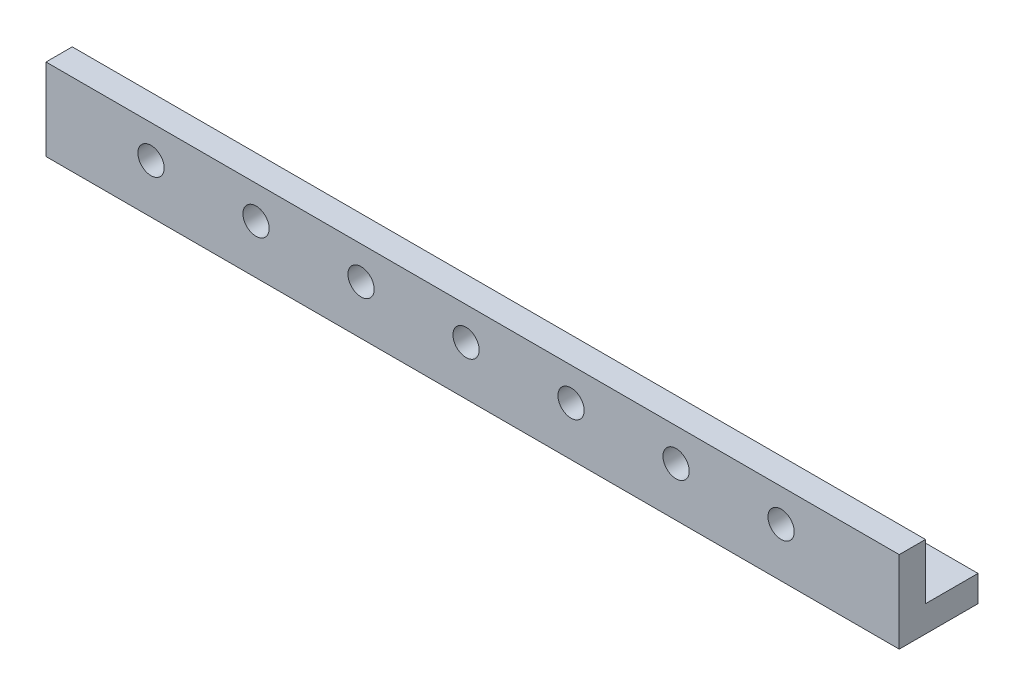
from build123d import *

# Parameters (mm, degrees)
BOSS_EXTRUDE1_DEPTH = 206.375
SKETCH2_R           = 3.175
CUT_EXTRUDE1_DEPTH  = 209.19716249
LPATTERN1_COUNT     = 7
LPATTERN1_PITCH     = 25.4


with BuildPart() as part:
    # Sketch1 → Boss-Extrude1 (new body)
    with BuildSketch(Plane(origin=(0, 0, 0), x_dir=(0, 0, -1), z_dir=(1, 0, 0))):
        Polygon((0, 0), (0, 19.812), (6.35, 19.812), (6.35, 6.35), (19.05, 6.35), (19.05, 0), align=None)
    extrude(amount=BOSS_EXTRUDE1_DEPTH)

    # Sketch2 → Cut-Extrude1 (cut, through all)
    with BuildSketch(Plane.XY):
        with Locations((25.4, 11.8745)):
            Circle(SKETCH2_R)
    cut_extrude1 = extrude(amount=-CUT_EXTRUDE1_DEPTH, mode=Mode.SUBTRACT)

    # LPattern1: Cut-Extrude1 ×7
    with Locations(*[(i * LPATTERN1_PITCH, 0, 0) for i in range(1, LPATTERN1_COUNT)]):
        add(cut_extrude1, mode=Mode.SUBTRACT)


solid = part.part
